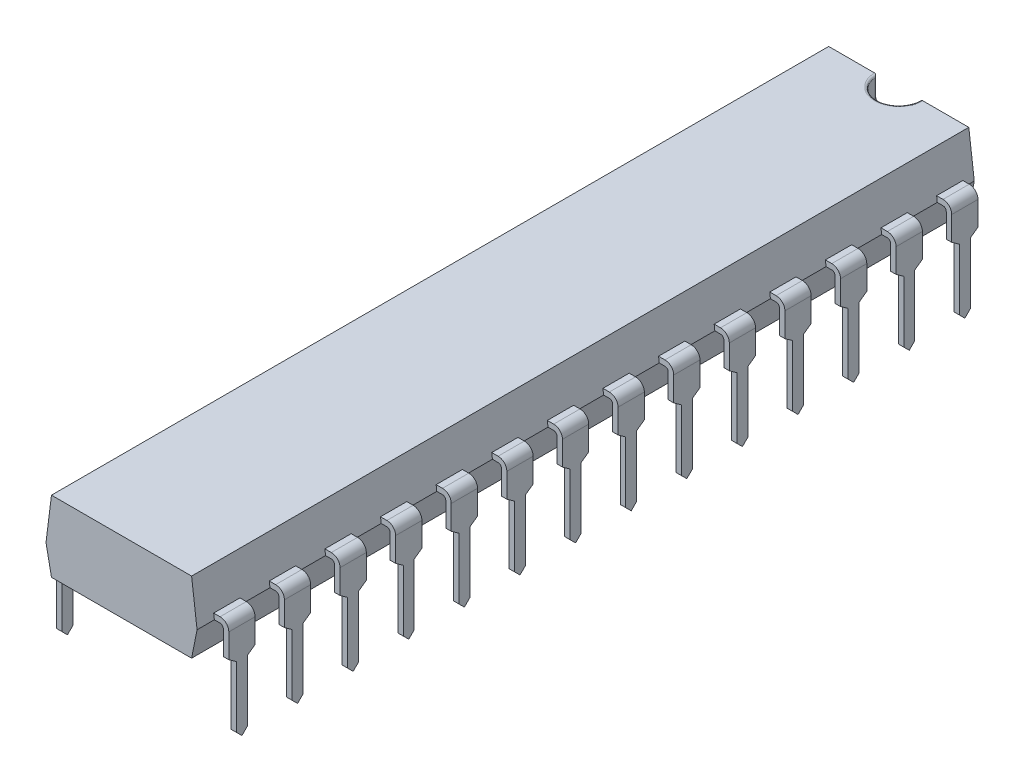
from build123d import *

# Parameters (mm, degrees)
BOSS_EXTRU_1_DEPTH                 = 35.5
BOSS_EXTRU_2_DEPTH                 = 0.6
ENL_V_MAT_EXTRU_1_DEPTH            = 0.5
R_P_TITION_LIN_AIRE1_COUNT         = 14
R_P_TITION_LIN_AIRE1_PITCH         = 2.54
R_P_TITION_LIN_AIRE1_COPY_1_DEPTH  = 0.5
R_P_TITION_LIN_AIRE1_COPY_2_DEPTH  = 0.5
R_P_TITION_LIN_AIRE1_COPY_3_DEPTH  = 0.5
R_P_TITION_LIN_AIRE1_COPY_4_DEPTH  = 0.5
R_P_TITION_LIN_AIRE1_COPY_5_DEPTH  = 0.5
R_P_TITION_LIN_AIRE1_COPY_6_DEPTH  = 0.5
R_P_TITION_LIN_AIRE1_COPY_7_DEPTH  = 0.5
R_P_TITION_LIN_AIRE1_COPY_8_DEPTH  = 0.5
R_P_TITION_LIN_AIRE1_COPY_9_DEPTH  = 0.5
R_P_TITION_LIN_AIRE1_COPY_10_DEPTH = 0.5
R_P_TITION_LIN_AIRE1_COPY_11_DEPTH = 0.5
R_P_TITION_LIN_AIRE1_COPY_12_DEPTH = 0.5
R_P_TITION_LIN_AIRE1_COPY_13_DEPTH = 0.5
SYM_TRIE2_COPY_1_DEPTH             = 0.5
SYM_TRIE2_COPY_2_DEPTH             = 0.6
SYM_TRIE2_COPY_3_DEPTH             = 0.6
SYM_TRIE2_COPY_4_DEPTH             = 0.6
SYM_TRIE2_COPY_5_DEPTH             = 0.6
SYM_TRIE2_COPY_6_DEPTH             = 0.6
SYM_TRIE2_COPY_7_DEPTH             = 0.6
SYM_TRIE2_COPY_8_DEPTH             = 0.6
SYM_TRIE2_COPY_9_DEPTH             = 0.6
SYM_TRIE2_COPY_10_DEPTH            = 0.6
SYM_TRIE2_COPY_11_DEPTH            = 0.6
SYM_TRIE2_COPY_12_DEPTH            = 0.6
SYM_TRIE2_COPY_13_DEPTH            = 0.6
SYM_TRIE2_COPY_14_DEPTH            = 0.6
SYM_TRIE2_COPY_15_DEPTH            = 0.5
SYM_TRIE2_COPY_16_DEPTH            = 0.5
SYM_TRIE2_COPY_17_DEPTH            = 0.5
SYM_TRIE2_COPY_18_DEPTH            = 0.5
SYM_TRIE2_COPY_19_DEPTH            = 0.5
SYM_TRIE2_COPY_20_DEPTH            = 0.5
SYM_TRIE2_COPY_21_DEPTH            = 0.5
SYM_TRIE2_COPY_22_DEPTH            = 0.5
SYM_TRIE2_COPY_23_DEPTH            = 0.5
SYM_TRIE2_COPY_24_DEPTH            = 0.5
SYM_TRIE2_COPY_25_DEPTH            = 0.5
SYM_TRIE2_COPY_26_DEPTH            = 0.5
SYM_TRIE2_COPY_27_DEPTH            = 0.5
SYM_TRIE2_COPY_28_DEPTH            = 0.5
SYM_TRIE2_COPY_29_DEPTH            = 0.5
SYM_TRIE2_COPY_30_DEPTH            = 0.5
SYM_TRIE2_COPY_31_DEPTH            = 0.5
SYM_TRIE2_COPY_32_DEPTH            = 0.5
SYM_TRIE2_COPY_33_DEPTH            = 0.5
SYM_TRIE2_COPY_34_DEPTH            = 0.5
SYM_TRIE2_COPY_35_DEPTH            = 0.5
SYM_TRIE2_COPY_36_DEPTH            = 0.5
SYM_TRIE2_COPY_37_DEPTH            = 0.5
SYM_TRIE2_COPY_38_DEPTH            = 0.5
SYM_TRIE2_COPY_39_DEPTH            = 0.5
SYM_TRIE2_COPY_40_DEPTH            = 0.5
ESQUISSE5_R                        = 1
ENL_V_MAT_EXTRU_2_DEPTH            = 1
CONG_2_R                           = 0.1


with BuildPart() as part:
    # Esquisse1 → Boss.-Extru.1 (new body)
    with BuildSketch(Plane.XY):
        Polygon((-3.45, -0.375), (-3.2, -1.625), (3.2, -1.625), (3.45, -0.375), (3.2, 1.625), (-3.2, 1.625), align=None)
    extrude(amount=BOSS_EXTRU_1_DEPTH)

    # Esquisse3 → Boss.-Extru.2 (add, symmetric)
    with BuildSketch(Plane.XY.offset(1.09)):
        with BuildLine():
            Line((3.185864291, -0.375), (3.71, -0.375))
            ThreePointArc((3.71, -0.375), (3.816066017, -0.418933983), (3.86, -0.525))
            Line((3.86, -0.525), (3.86, -4.925))
            Line((3.86, -4.925), (4.11, -4.925))
            Line((4.11, -4.925), (4.11, -0.525))
            ThreePointArc((4.11, -0.525), (3.992842712, -0.242157288), (3.71, -0.125))
            Line((3.71, -0.125), (3.185864291, -0.125))
            Line((3.185864291, -0.125), (3.185864291, -0.375))
        make_face()
    boss_extru_2 = extrude(amount=BOSS_EXTRU_2_DEPTH, both=True)

    # Esquisse4 → Enlèv. mat.-Extru.1 (cut)
    with BuildSketch(Plane(origin=(4.11, 0, 0), x_dir=(0, 0, -1), z_dir=(1, 0, 0))):
        Polygon((-1.34, -4.675), (-1.34, -1.875), (-1.69, -1.625), (-1.907040734, -1.625), (-1.907040734, -4.925), (-1.09, -4.925), align=None)
    enl_v_mat_extru_1 = extrude(amount=-ENL_V_MAT_EXTRU_1_DEPTH, mode=Mode.SUBTRACT)

    # Symétrie1: Enlèv. mat.-Extru.1 across plane
    add(enl_v_mat_extru_1.mirror(Plane.XY.offset(1.09)), mode=Mode.SUBTRACT)

    # Répétition linéaire1: Boss.-Extru.2, Enlèv. mat.-Extru.1 ×14
    with Locations(*[(0, 0, i * R_P_TITION_LIN_AIRE1_PITCH) for i in range(1, R_P_TITION_LIN_AIRE1_COUNT)]):
        add(boss_extru_2)
        add(enl_v_mat_extru_1, mode=Mode.SUBTRACT)

    # Répétition linéaire1 copy 1 sketch → Répétition linéaire1 copy 1 (cut)
    with BuildSketch(Plane(origin=(4.11, 0, 4.72), x_dir=(0, 0, 1), z_dir=(1, 0, 0))):
        Polygon((-1.34, 4.675), (-1.34, 1.875), (-1.69, 1.625), (-1.907040734, 1.625), (-1.907040734, 4.925), (-1.09, 4.925), align=None)
    extrude(amount=-R_P_TITION_LIN_AIRE1_COPY_1_DEPTH, mode=Mode.SUBTRACT)

    # Répétition linéaire1 copy 2 sketch → Répétition linéaire1 copy 2 (cut)
    with BuildSketch(Plane(origin=(4.11, 0, 7.26), x_dir=(0, 0, 1), z_dir=(1, 0, 0))):
        Polygon((-1.34, 4.675), (-1.34, 1.875), (-1.69, 1.625), (-1.907040734, 1.625), (-1.907040734, 4.925), (-1.09, 4.925), align=None)
    extrude(amount=-R_P_TITION_LIN_AIRE1_COPY_2_DEPTH, mode=Mode.SUBTRACT)

    # Répétition linéaire1 copy 3 sketch → Répétition linéaire1 copy 3 (cut)
    with BuildSketch(Plane(origin=(4.11, 0, 9.8), x_dir=(0, 0, 1), z_dir=(1, 0, 0))):
        Polygon((-1.34, 4.675), (-1.34, 1.875), (-1.69, 1.625), (-1.907040734, 1.625), (-1.907040734, 4.925), (-1.09, 4.925), align=None)
    extrude(amount=-R_P_TITION_LIN_AIRE1_COPY_3_DEPTH, mode=Mode.SUBTRACT)

    # Répétition linéaire1 copy 4 sketch → Répétition linéaire1 copy 4 (cut)
    with BuildSketch(Plane(origin=(4.11, 0, 12.34), x_dir=(0, 0, 1), z_dir=(1, 0, 0))):
        Polygon((-1.34, 4.675), (-1.34, 1.875), (-1.69, 1.625), (-1.907040734, 1.625), (-1.907040734, 4.925), (-1.09, 4.925), align=None)
    extrude(amount=-R_P_TITION_LIN_AIRE1_COPY_4_DEPTH, mode=Mode.SUBTRACT)

    # Répétition linéaire1 copy 5 sketch → Répétition linéaire1 copy 5 (cut)
    with BuildSketch(Plane(origin=(4.11, 0, 14.88), x_dir=(0, 0, 1), z_dir=(1, 0, 0))):
        Polygon((-1.34, 4.675), (-1.34, 1.875), (-1.69, 1.625), (-1.907040734, 1.625), (-1.907040734, 4.925), (-1.09, 4.925), align=None)
    extrude(amount=-R_P_TITION_LIN_AIRE1_COPY_5_DEPTH, mode=Mode.SUBTRACT)

    # Répétition linéaire1 copy 6 sketch → Répétition linéaire1 copy 6 (cut)
    with BuildSketch(Plane(origin=(4.11, 0, 17.42), x_dir=(0, 0, 1), z_dir=(1, 0, 0))):
        Polygon((-1.34, 4.675), (-1.34, 1.875), (-1.69, 1.625), (-1.907040734, 1.625), (-1.907040734, 4.925), (-1.09, 4.925), align=None)
    extrude(amount=-R_P_TITION_LIN_AIRE1_COPY_6_DEPTH, mode=Mode.SUBTRACT)

    # Répétition linéaire1 copy 7 sketch → Répétition linéaire1 copy 7 (cut)
    with BuildSketch(Plane(origin=(4.11, 0, 19.96), x_dir=(0, 0, 1), z_dir=(1, 0, 0))):
        Polygon((-1.34, 4.675), (-1.34, 1.875), (-1.69, 1.625), (-1.907040734, 1.625), (-1.907040734, 4.925), (-1.09, 4.925), align=None)
    extrude(amount=-R_P_TITION_LIN_AIRE1_COPY_7_DEPTH, mode=Mode.SUBTRACT)

    # Répétition linéaire1 copy 8 sketch → Répétition linéaire1 copy 8 (cut)
    with BuildSketch(Plane(origin=(4.11, 0, 22.5), x_dir=(0, 0, 1), z_dir=(1, 0, 0))):
        Polygon((-1.34, 4.675), (-1.34, 1.875), (-1.69, 1.625), (-1.907040734, 1.625), (-1.907040734, 4.925), (-1.09, 4.925), align=None)
    extrude(amount=-R_P_TITION_LIN_AIRE1_COPY_8_DEPTH, mode=Mode.SUBTRACT)

    # Répétition linéaire1 copy 9 sketch → Répétition linéaire1 copy 9 (cut)
    with BuildSketch(Plane(origin=(4.11, 0, 25.04), x_dir=(0, 0, 1), z_dir=(1, 0, 0))):
        Polygon((-1.34, 4.675), (-1.34, 1.875), (-1.69, 1.625), (-1.907040734, 1.625), (-1.907040734, 4.925), (-1.09, 4.925), align=None)
    extrude(amount=-R_P_TITION_LIN_AIRE1_COPY_9_DEPTH, mode=Mode.SUBTRACT)

    # Répétition linéaire1 copy 10 sketch → Répétition linéaire1 copy 10 (cut)
    with BuildSketch(Plane(origin=(4.11, 0, 27.58), x_dir=(0, 0, 1), z_dir=(1, 0, 0))):
        Polygon((-1.34, 4.675), (-1.34, 1.875), (-1.69, 1.625), (-1.907040734, 1.625), (-1.907040734, 4.925), (-1.09, 4.925), align=None)
    extrude(amount=-R_P_TITION_LIN_AIRE1_COPY_10_DEPTH, mode=Mode.SUBTRACT)

    # Répétition linéaire1 copy 11 sketch → Répétition linéaire1 copy 11 (cut)
    with BuildSketch(Plane(origin=(4.11, 0, 30.12), x_dir=(0, 0, 1), z_dir=(1, 0, 0))):
        Polygon((-1.34, 4.675), (-1.34, 1.875), (-1.69, 1.625), (-1.907040734, 1.625), (-1.907040734, 4.925), (-1.09, 4.925), align=None)
    extrude(amount=-R_P_TITION_LIN_AIRE1_COPY_11_DEPTH, mode=Mode.SUBTRACT)

    # Répétition linéaire1 copy 12 sketch → Répétition linéaire1 copy 12 (cut)
    with BuildSketch(Plane(origin=(4.11, 0, 32.66), x_dir=(0, 0, 1), z_dir=(1, 0, 0))):
        Polygon((-1.34, 4.675), (-1.34, 1.875), (-1.69, 1.625), (-1.907040734, 1.625), (-1.907040734, 4.925), (-1.09, 4.925), align=None)
    extrude(amount=-R_P_TITION_LIN_AIRE1_COPY_12_DEPTH, mode=Mode.SUBTRACT)

    # Répétition linéaire1 copy 13 sketch → Répétition linéaire1 copy 13 (cut)
    with BuildSketch(Plane(origin=(4.11, 0, 35.2), x_dir=(0, 0, 1), z_dir=(1, 0, 0))):
        Polygon((-1.34, 4.675), (-1.34, 1.875), (-1.69, 1.625), (-1.907040734, 1.625), (-1.907040734, 4.925), (-1.09, 4.925), align=None)
    extrude(amount=-R_P_TITION_LIN_AIRE1_COPY_13_DEPTH, mode=Mode.SUBTRACT)

    # Symétrie2: Boss.-Extru.2, Enlèv. mat.-Extru.1 across plane
    add(boss_extru_2.mirror(Plane(origin=(0, 0, 0), x_dir=(0, 0, 1), z_dir=(1, 0, 0))))
    add(enl_v_mat_extru_1.mirror(Plane(origin=(0, 0, 0), x_dir=(0, 0, 1), z_dir=(1, 0, 0))), mode=Mode.SUBTRACT)

    # Symétrie2 copy 1 sketch → Symétrie2 copy 1 (cut)
    with BuildSketch(Plane(origin=(-4.11, 0, 2.18), x_dir=(0, 0, 1), z_dir=(-1, 0, 0))):
        Polygon((-1.34, -4.675), (-1.34, -1.875), (-1.69, -1.625), (-1.907040734, -1.625), (-1.907040734, -4.925), (-1.09, -4.925), align=None)
    extrude(amount=-SYM_TRIE2_COPY_1_DEPTH, mode=Mode.SUBTRACT)

    # Symétrie2 copy 2 sketch → Symétrie2 copy 2 (add, symmetric)
    with BuildSketch(Plane(origin=(0, 0, 3.63), x_dir=(-1, 0, 0), z_dir=(0, 0, 1))):
        with BuildLine():
            Line((3.185864291, 0.375), (3.71, 0.375))
            ThreePointArc((3.71, 0.375), (3.816066017, 0.418933983), (3.86, 0.525))
            Line((3.86, 0.525), (3.86, 4.925))
            Line((3.86, 4.925), (4.11, 4.925))
            Line((4.11, 4.925), (4.11, 0.525))
            ThreePointArc((4.11, 0.525), (3.992842712, 0.242157288), (3.71, 0.125))
            Line((3.71, 0.125), (3.185864291, 0.125))
            Line((3.185864291, 0.125), (3.185864291, 0.375))
        make_face()
    extrude(amount=SYM_TRIE2_COPY_2_DEPTH, both=True)

    # Symétrie2 copy 3 sketch → Symétrie2 copy 3 (add, symmetric)
    with BuildSketch(Plane(origin=(0, 0, 6.17), x_dir=(-1, 0, 0), z_dir=(0, 0, 1))):
        with BuildLine():
            Line((3.185864291, 0.375), (3.71, 0.375))
            ThreePointArc((3.71, 0.375), (3.816066017, 0.418933983), (3.86, 0.525))
            Line((3.86, 0.525), (3.86, 4.925))
            Line((3.86, 4.925), (4.11, 4.925))
            Line((4.11, 4.925), (4.11, 0.525))
            ThreePointArc((4.11, 0.525), (3.992842712, 0.242157288), (3.71, 0.125))
            Line((3.71, 0.125), (3.185864291, 0.125))
            Line((3.185864291, 0.125), (3.185864291, 0.375))
        make_face()
    extrude(amount=SYM_TRIE2_COPY_3_DEPTH, both=True)

    # Symétrie2 copy 4 sketch → Symétrie2 copy 4 (add, symmetric)
    with BuildSketch(Plane(origin=(0, 0, 8.71), x_dir=(-1, 0, 0), z_dir=(0, 0, 1))):
        with BuildLine():
            Line((3.185864291, 0.375), (3.71, 0.375))
            ThreePointArc((3.71, 0.375), (3.816066017, 0.418933983), (3.86, 0.525))
            Line((3.86, 0.525), (3.86, 4.925))
            Line((3.86, 4.925), (4.11, 4.925))
            Line((4.11, 4.925), (4.11, 0.525))
            ThreePointArc((4.11, 0.525), (3.992842712, 0.242157288), (3.71, 0.125))
            Line((3.71, 0.125), (3.185864291, 0.125))
            Line((3.185864291, 0.125), (3.185864291, 0.375))
        make_face()
    extrude(amount=SYM_TRIE2_COPY_4_DEPTH, both=True)

    # Symétrie2 copy 5 sketch → Symétrie2 copy 5 (add, symmetric)
    with BuildSketch(Plane(origin=(0, 0, 11.25), x_dir=(-1, 0, 0), z_dir=(0, 0, 1))):
        with BuildLine():
            Line((3.185864291, 0.375), (3.71, 0.375))
            ThreePointArc((3.71, 0.375), (3.816066017, 0.418933983), (3.86, 0.525))
            Line((3.86, 0.525), (3.86, 4.925))
            Line((3.86, 4.925), (4.11, 4.925))
            Line((4.11, 4.925), (4.11, 0.525))
            ThreePointArc((4.11, 0.525), (3.992842712, 0.242157288), (3.71, 0.125))
            Line((3.71, 0.125), (3.185864291, 0.125))
            Line((3.185864291, 0.125), (3.185864291, 0.375))
        make_face()
    extrude(amount=SYM_TRIE2_COPY_5_DEPTH, both=True)

    # Symétrie2 copy 6 sketch → Symétrie2 copy 6 (add, symmetric)
    with BuildSketch(Plane(origin=(0, 0, 13.79), x_dir=(-1, 0, 0), z_dir=(0, 0, 1))):
        with BuildLine():
            Line((3.185864291, 0.375), (3.71, 0.375))
            ThreePointArc((3.71, 0.375), (3.816066017, 0.418933983), (3.86, 0.525))
            Line((3.86, 0.525), (3.86, 4.925))
            Line((3.86, 4.925), (4.11, 4.925))
            Line((4.11, 4.925), (4.11, 0.525))
            ThreePointArc((4.11, 0.525), (3.992842712, 0.242157288), (3.71, 0.125))
            Line((3.71, 0.125), (3.185864291, 0.125))
            Line((3.185864291, 0.125), (3.185864291, 0.375))
        make_face()
    extrude(amount=SYM_TRIE2_COPY_6_DEPTH, both=True)

    # Symétrie2 copy 7 sketch → Symétrie2 copy 7 (add, symmetric)
    with BuildSketch(Plane(origin=(0, 0, 16.33), x_dir=(-1, 0, 0), z_dir=(0, 0, 1))):
        with BuildLine():
            Line((3.185864291, 0.375), (3.71, 0.375))
            ThreePointArc((3.71, 0.375), (3.816066017, 0.418933983), (3.86, 0.525))
            Line((3.86, 0.525), (3.86, 4.925))
            Line((3.86, 4.925), (4.11, 4.925))
            Line((4.11, 4.925), (4.11, 0.525))
            ThreePointArc((4.11, 0.525), (3.992842712, 0.242157288), (3.71, 0.125))
            Line((3.71, 0.125), (3.185864291, 0.125))
            Line((3.185864291, 0.125), (3.185864291, 0.375))
        make_face()
    extrude(amount=SYM_TRIE2_COPY_7_DEPTH, both=True)

    # Symétrie2 copy 8 sketch → Symétrie2 copy 8 (add, symmetric)
    with BuildSketch(Plane(origin=(0, 0, 18.87), x_dir=(-1, 0, 0), z_dir=(0, 0, 1))):
        with BuildLine():
            Line((3.185864291, 0.375), (3.71, 0.375))
            ThreePointArc((3.71, 0.375), (3.816066017, 0.418933983), (3.86, 0.525))
            Line((3.86, 0.525), (3.86, 4.925))
            Line((3.86, 4.925), (4.11, 4.925))
            Line((4.11, 4.925), (4.11, 0.525))
            ThreePointArc((4.11, 0.525), (3.992842712, 0.242157288), (3.71, 0.125))
            Line((3.71, 0.125), (3.185864291, 0.125))
            Line((3.185864291, 0.125), (3.185864291, 0.375))
        make_face()
    extrude(amount=SYM_TRIE2_COPY_8_DEPTH, both=True)

    # Symétrie2 copy 9 sketch → Symétrie2 copy 9 (add, symmetric)
    with BuildSketch(Plane(origin=(0, 0, 21.41), x_dir=(-1, 0, 0), z_dir=(0, 0, 1))):
        with BuildLine():
            Line((3.185864291, 0.375), (3.71, 0.375))
            ThreePointArc((3.71, 0.375), (3.816066017, 0.418933983), (3.86, 0.525))
            Line((3.86, 0.525), (3.86, 4.925))
            Line((3.86, 4.925), (4.11, 4.925))
            Line((4.11, 4.925), (4.11, 0.525))
            ThreePointArc((4.11, 0.525), (3.992842712, 0.242157288), (3.71, 0.125))
            Line((3.71, 0.125), (3.185864291, 0.125))
            Line((3.185864291, 0.125), (3.185864291, 0.375))
        make_face()
    extrude(amount=SYM_TRIE2_COPY_9_DEPTH, both=True)

    # Symétrie2 copy 10 sketch → Symétrie2 copy 10 (add, symmetric)
    with BuildSketch(Plane(origin=(0, 0, 23.95), x_dir=(-1, 0, 0), z_dir=(0, 0, 1))):
        with BuildLine():
            Line((3.185864291, 0.375), (3.71, 0.375))
            ThreePointArc((3.71, 0.375), (3.816066017, 0.418933983), (3.86, 0.525))
            Line((3.86, 0.525), (3.86, 4.925))
            Line((3.86, 4.925), (4.11, 4.925))
            Line((4.11, 4.925), (4.11, 0.525))
            ThreePointArc((4.11, 0.525), (3.992842712, 0.242157288), (3.71, 0.125))
            Line((3.71, 0.125), (3.185864291, 0.125))
            Line((3.185864291, 0.125), (3.185864291, 0.375))
        make_face()
    extrude(amount=SYM_TRIE2_COPY_10_DEPTH, both=True)

    # Symétrie2 copy 11 sketch → Symétrie2 copy 11 (add, symmetric)
    with BuildSketch(Plane(origin=(0, 0, 26.49), x_dir=(-1, 0, 0), z_dir=(0, 0, 1))):
        with BuildLine():
            Line((3.185864291, 0.375), (3.71, 0.375))
            ThreePointArc((3.71, 0.375), (3.816066017, 0.418933983), (3.86, 0.525))
            Line((3.86, 0.525), (3.86, 4.925))
            Line((3.86, 4.925), (4.11, 4.925))
            Line((4.11, 4.925), (4.11, 0.525))
            ThreePointArc((4.11, 0.525), (3.992842712, 0.242157288), (3.71, 0.125))
            Line((3.71, 0.125), (3.185864291, 0.125))
            Line((3.185864291, 0.125), (3.185864291, 0.375))
        make_face()
    extrude(amount=SYM_TRIE2_COPY_11_DEPTH, both=True)

    # Symétrie2 copy 12 sketch → Symétrie2 copy 12 (add, symmetric)
    with BuildSketch(Plane(origin=(0, 0, 29.03), x_dir=(-1, 0, 0), z_dir=(0, 0, 1))):
        with BuildLine():
            Line((3.185864291, 0.375), (3.71, 0.375))
            ThreePointArc((3.71, 0.375), (3.816066017, 0.418933983), (3.86, 0.525))
            Line((3.86, 0.525), (3.86, 4.925))
            Line((3.86, 4.925), (4.11, 4.925))
            Line((4.11, 4.925), (4.11, 0.525))
            ThreePointArc((4.11, 0.525), (3.992842712, 0.242157288), (3.71, 0.125))
            Line((3.71, 0.125), (3.185864291, 0.125))
            Line((3.185864291, 0.125), (3.185864291, 0.375))
        make_face()
    extrude(amount=SYM_TRIE2_COPY_12_DEPTH, both=True)

    # Symétrie2 copy 13 sketch → Symétrie2 copy 13 (add, symmetric)
    with BuildSketch(Plane(origin=(0, 0, 31.57), x_dir=(-1, 0, 0), z_dir=(0, 0, 1))):
        with BuildLine():
            Line((3.185864291, 0.375), (3.71, 0.375))
            ThreePointArc((3.71, 0.375), (3.816066017, 0.418933983), (3.86, 0.525))
            Line((3.86, 0.525), (3.86, 4.925))
            Line((3.86, 4.925), (4.11, 4.925))
            Line((4.11, 4.925), (4.11, 0.525))
            ThreePointArc((4.11, 0.525), (3.992842712, 0.242157288), (3.71, 0.125))
            Line((3.71, 0.125), (3.185864291, 0.125))
            Line((3.185864291, 0.125), (3.185864291, 0.375))
        make_face()
    extrude(amount=SYM_TRIE2_COPY_13_DEPTH, both=True)

    # Symétrie2 copy 14 sketch → Symétrie2 copy 14 (add, symmetric)
    with BuildSketch(Plane(origin=(0, 0, 34.11), x_dir=(-1, 0, 0), z_dir=(0, 0, 1))):
        with BuildLine():
            Line((3.185864291, 0.375), (3.71, 0.375))
            ThreePointArc((3.71, 0.375), (3.816066017, 0.418933983), (3.86, 0.525))
            Line((3.86, 0.525), (3.86, 4.925))
            Line((3.86, 4.925), (4.11, 4.925))
            Line((4.11, 4.925), (4.11, 0.525))
            ThreePointArc((4.11, 0.525), (3.992842712, 0.242157288), (3.71, 0.125))
            Line((3.71, 0.125), (3.185864291, 0.125))
            Line((3.185864291, 0.125), (3.185864291, 0.375))
        make_face()
    extrude(amount=SYM_TRIE2_COPY_14_DEPTH, both=True)

    # Symétrie2 copy 15 sketch → Symétrie2 copy 15 (cut)
    with BuildSketch(Plane(origin=(-4.11, 0, 2.54), x_dir=(0, 0, -1), z_dir=(-1, 0, 0))):
        Polygon((-1.34, 4.675), (-1.34, 1.875), (-1.69, 1.625), (-1.907040734, 1.625), (-1.907040734, 4.925), (-1.09, 4.925), align=None)
    extrude(amount=-SYM_TRIE2_COPY_15_DEPTH, mode=Mode.SUBTRACT)

    # Symétrie2 copy 16 sketch → Symétrie2 copy 16 (cut)
    with BuildSketch(Plane(origin=(-4.11, 0, 5.08), x_dir=(0, 0, -1), z_dir=(-1, 0, 0))):
        Polygon((-1.34, 4.675), (-1.34, 1.875), (-1.69, 1.625), (-1.907040734, 1.625), (-1.907040734, 4.925), (-1.09, 4.925), align=None)
    extrude(amount=-SYM_TRIE2_COPY_16_DEPTH, mode=Mode.SUBTRACT)

    # Symétrie2 copy 17 sketch → Symétrie2 copy 17 (cut)
    with BuildSketch(Plane(origin=(-4.11, 0, 7.62), x_dir=(0, 0, -1), z_dir=(-1, 0, 0))):
        Polygon((-1.34, 4.675), (-1.34, 1.875), (-1.69, 1.625), (-1.907040734, 1.625), (-1.907040734, 4.925), (-1.09, 4.925), align=None)
    extrude(amount=-SYM_TRIE2_COPY_17_DEPTH, mode=Mode.SUBTRACT)

    # Symétrie2 copy 18 sketch → Symétrie2 copy 18 (cut)
    with BuildSketch(Plane(origin=(-4.11, 0, 10.16), x_dir=(0, 0, -1), z_dir=(-1, 0, 0))):
        Polygon((-1.34, 4.675), (-1.34, 1.875), (-1.69, 1.625), (-1.907040734, 1.625), (-1.907040734, 4.925), (-1.09, 4.925), align=None)
    extrude(amount=-SYM_TRIE2_COPY_18_DEPTH, mode=Mode.SUBTRACT)

    # Symétrie2 copy 19 sketch → Symétrie2 copy 19 (cut)
    with BuildSketch(Plane(origin=(-4.11, 0, 12.7), x_dir=(0, 0, -1), z_dir=(-1, 0, 0))):
        Polygon((-1.34, 4.675), (-1.34, 1.875), (-1.69, 1.625), (-1.907040734, 1.625), (-1.907040734, 4.925), (-1.09, 4.925), align=None)
    extrude(amount=-SYM_TRIE2_COPY_19_DEPTH, mode=Mode.SUBTRACT)

    # Symétrie2 copy 20 sketch → Symétrie2 copy 20 (cut)
    with BuildSketch(Plane(origin=(-4.11, 0, 15.24), x_dir=(0, 0, -1), z_dir=(-1, 0, 0))):
        Polygon((-1.34, 4.675), (-1.34, 1.875), (-1.69, 1.625), (-1.907040734, 1.625), (-1.907040734, 4.925), (-1.09, 4.925), align=None)
    extrude(amount=-SYM_TRIE2_COPY_20_DEPTH, mode=Mode.SUBTRACT)

    # Symétrie2 copy 21 sketch → Symétrie2 copy 21 (cut)
    with BuildSketch(Plane(origin=(-4.11, 0, 17.78), x_dir=(0, 0, -1), z_dir=(-1, 0, 0))):
        Polygon((-1.34, 4.675), (-1.34, 1.875), (-1.69, 1.625), (-1.907040734, 1.625), (-1.907040734, 4.925), (-1.09, 4.925), align=None)
    extrude(amount=-SYM_TRIE2_COPY_21_DEPTH, mode=Mode.SUBTRACT)

    # Symétrie2 copy 22 sketch → Symétrie2 copy 22 (cut)
    with BuildSketch(Plane(origin=(-4.11, 0, 20.32), x_dir=(0, 0, -1), z_dir=(-1, 0, 0))):
        Polygon((-1.34, 4.675), (-1.34, 1.875), (-1.69, 1.625), (-1.907040734, 1.625), (-1.907040734, 4.925), (-1.09, 4.925), align=None)
    extrude(amount=-SYM_TRIE2_COPY_22_DEPTH, mode=Mode.SUBTRACT)

    # Symétrie2 copy 23 sketch → Symétrie2 copy 23 (cut)
    with BuildSketch(Plane(origin=(-4.11, 0, 22.86), x_dir=(0, 0, -1), z_dir=(-1, 0, 0))):
        Polygon((-1.34, 4.675), (-1.34, 1.875), (-1.69, 1.625), (-1.907040734, 1.625), (-1.907040734, 4.925), (-1.09, 4.925), align=None)
    extrude(amount=-SYM_TRIE2_COPY_23_DEPTH, mode=Mode.SUBTRACT)

    # Symétrie2 copy 24 sketch → Symétrie2 copy 24 (cut)
    with BuildSketch(Plane(origin=(-4.11, 0, 25.4), x_dir=(0, 0, -1), z_dir=(-1, 0, 0))):
        Polygon((-1.34, 4.675), (-1.34, 1.875), (-1.69, 1.625), (-1.907040734, 1.625), (-1.907040734, 4.925), (-1.09, 4.925), align=None)
    extrude(amount=-SYM_TRIE2_COPY_24_DEPTH, mode=Mode.SUBTRACT)

    # Symétrie2 copy 25 sketch → Symétrie2 copy 25 (cut)
    with BuildSketch(Plane(origin=(-4.11, 0, 27.94), x_dir=(0, 0, -1), z_dir=(-1, 0, 0))):
        Polygon((-1.34, 4.675), (-1.34, 1.875), (-1.69, 1.625), (-1.907040734, 1.625), (-1.907040734, 4.925), (-1.09, 4.925), align=None)
    extrude(amount=-SYM_TRIE2_COPY_25_DEPTH, mode=Mode.SUBTRACT)

    # Symétrie2 copy 26 sketch → Symétrie2 copy 26 (cut)
    with BuildSketch(Plane(origin=(-4.11, 0, 30.48), x_dir=(0, 0, -1), z_dir=(-1, 0, 0))):
        Polygon((-1.34, 4.675), (-1.34, 1.875), (-1.69, 1.625), (-1.907040734, 1.625), (-1.907040734, 4.925), (-1.09, 4.925), align=None)
    extrude(amount=-SYM_TRIE2_COPY_26_DEPTH, mode=Mode.SUBTRACT)

    # Symétrie2 copy 27 sketch → Symétrie2 copy 27 (cut)
    with BuildSketch(Plane(origin=(-4.11, 0, 33.02), x_dir=(0, 0, -1), z_dir=(-1, 0, 0))):
        Polygon((-1.34, 4.675), (-1.34, 1.875), (-1.69, 1.625), (-1.907040734, 1.625), (-1.907040734, 4.925), (-1.09, 4.925), align=None)
    extrude(amount=-SYM_TRIE2_COPY_27_DEPTH, mode=Mode.SUBTRACT)

    # Symétrie2 copy 28 sketch → Symétrie2 copy 28 (cut)
    with BuildSketch(Plane(origin=(-4.11, 0, 4.72), x_dir=(0, 0, 1), z_dir=(-1, 0, 0))):
        Polygon((-1.34, -4.675), (-1.34, -1.875), (-1.69, -1.625), (-1.907040734, -1.625), (-1.907040734, -4.925), (-1.09, -4.925), align=None)
    extrude(amount=-SYM_TRIE2_COPY_28_DEPTH, mode=Mode.SUBTRACT)

    # Symétrie2 copy 29 sketch → Symétrie2 copy 29 (cut)
    with BuildSketch(Plane(origin=(-4.11, 0, 7.26), x_dir=(0, 0, 1), z_dir=(-1, 0, 0))):
        Polygon((-1.34, -4.675), (-1.34, -1.875), (-1.69, -1.625), (-1.907040734, -1.625), (-1.907040734, -4.925), (-1.09, -4.925), align=None)
    extrude(amount=-SYM_TRIE2_COPY_29_DEPTH, mode=Mode.SUBTRACT)

    # Symétrie2 copy 30 sketch → Symétrie2 copy 30 (cut)
    with BuildSketch(Plane(origin=(-4.11, 0, 9.8), x_dir=(0, 0, 1), z_dir=(-1, 0, 0))):
        Polygon((-1.34, -4.675), (-1.34, -1.875), (-1.69, -1.625), (-1.907040734, -1.625), (-1.907040734, -4.925), (-1.09, -4.925), align=None)
    extrude(amount=-SYM_TRIE2_COPY_30_DEPTH, mode=Mode.SUBTRACT)

    # Symétrie2 copy 31 sketch → Symétrie2 copy 31 (cut)
    with BuildSketch(Plane(origin=(-4.11, 0, 12.34), x_dir=(0, 0, 1), z_dir=(-1, 0, 0))):
        Polygon((-1.34, -4.675), (-1.34, -1.875), (-1.69, -1.625), (-1.907040734, -1.625), (-1.907040734, -4.925), (-1.09, -4.925), align=None)
    extrude(amount=-SYM_TRIE2_COPY_31_DEPTH, mode=Mode.SUBTRACT)

    # Symétrie2 copy 32 sketch → Symétrie2 copy 32 (cut)
    with BuildSketch(Plane(origin=(-4.11, 0, 14.88), x_dir=(0, 0, 1), z_dir=(-1, 0, 0))):
        Polygon((-1.34, -4.675), (-1.34, -1.875), (-1.69, -1.625), (-1.907040734, -1.625), (-1.907040734, -4.925), (-1.09, -4.925), align=None)
    extrude(amount=-SYM_TRIE2_COPY_32_DEPTH, mode=Mode.SUBTRACT)

    # Symétrie2 copy 33 sketch → Symétrie2 copy 33 (cut)
    with BuildSketch(Plane(origin=(-4.11, 0, 17.42), x_dir=(0, 0, 1), z_dir=(-1, 0, 0))):
        Polygon((-1.34, -4.675), (-1.34, -1.875), (-1.69, -1.625), (-1.907040734, -1.625), (-1.907040734, -4.925), (-1.09, -4.925), align=None)
    extrude(amount=-SYM_TRIE2_COPY_33_DEPTH, mode=Mode.SUBTRACT)

    # Symétrie2 copy 34 sketch → Symétrie2 copy 34 (cut)
    with BuildSketch(Plane(origin=(-4.11, 0, 19.96), x_dir=(0, 0, 1), z_dir=(-1, 0, 0))):
        Polygon((-1.34, -4.675), (-1.34, -1.875), (-1.69, -1.625), (-1.907040734, -1.625), (-1.907040734, -4.925), (-1.09, -4.925), align=None)
    extrude(amount=-SYM_TRIE2_COPY_34_DEPTH, mode=Mode.SUBTRACT)

    # Symétrie2 copy 35 sketch → Symétrie2 copy 35 (cut)
    with BuildSketch(Plane(origin=(-4.11, 0, 22.5), x_dir=(0, 0, 1), z_dir=(-1, 0, 0))):
        Polygon((-1.34, -4.675), (-1.34, -1.875), (-1.69, -1.625), (-1.907040734, -1.625), (-1.907040734, -4.925), (-1.09, -4.925), align=None)
    extrude(amount=-SYM_TRIE2_COPY_35_DEPTH, mode=Mode.SUBTRACT)

    # Symétrie2 copy 36 sketch → Symétrie2 copy 36 (cut)
    with BuildSketch(Plane(origin=(-4.11, 0, 25.04), x_dir=(0, 0, 1), z_dir=(-1, 0, 0))):
        Polygon((-1.34, -4.675), (-1.34, -1.875), (-1.69, -1.625), (-1.907040734, -1.625), (-1.907040734, -4.925), (-1.09, -4.925), align=None)
    extrude(amount=-SYM_TRIE2_COPY_36_DEPTH, mode=Mode.SUBTRACT)

    # Symétrie2 copy 37 sketch → Symétrie2 copy 37 (cut)
    with BuildSketch(Plane(origin=(-4.11, 0, 27.58), x_dir=(0, 0, 1), z_dir=(-1, 0, 0))):
        Polygon((-1.34, -4.675), (-1.34, -1.875), (-1.69, -1.625), (-1.907040734, -1.625), (-1.907040734, -4.925), (-1.09, -4.925), align=None)
    extrude(amount=-SYM_TRIE2_COPY_37_DEPTH, mode=Mode.SUBTRACT)

    # Symétrie2 copy 38 sketch → Symétrie2 copy 38 (cut)
    with BuildSketch(Plane(origin=(-4.11, 0, 30.12), x_dir=(0, 0, 1), z_dir=(-1, 0, 0))):
        Polygon((-1.34, -4.675), (-1.34, -1.875), (-1.69, -1.625), (-1.907040734, -1.625), (-1.907040734, -4.925), (-1.09, -4.925), align=None)
    extrude(amount=-SYM_TRIE2_COPY_38_DEPTH, mode=Mode.SUBTRACT)

    # Symétrie2 copy 39 sketch → Symétrie2 copy 39 (cut)
    with BuildSketch(Plane(origin=(-4.11, 0, 32.66), x_dir=(0, 0, 1), z_dir=(-1, 0, 0))):
        Polygon((-1.34, -4.675), (-1.34, -1.875), (-1.69, -1.625), (-1.907040734, -1.625), (-1.907040734, -4.925), (-1.09, -4.925), align=None)
    extrude(amount=-SYM_TRIE2_COPY_39_DEPTH, mode=Mode.SUBTRACT)

    # Symétrie2 copy 40 sketch → Symétrie2 copy 40 (cut)
    with BuildSketch(Plane(origin=(-4.11, 0, 35.2), x_dir=(0, 0, 1), z_dir=(-1, 0, 0))):
        Polygon((-1.34, -4.675), (-1.34, -1.875), (-1.69, -1.625), (-1.907040734, -1.625), (-1.907040734, -4.925), (-1.09, -4.925), align=None)
    extrude(amount=-SYM_TRIE2_COPY_40_DEPTH, mode=Mode.SUBTRACT)

    # Esquisse5 → Enlèv. mat.-Extru.2 (cut)
    with BuildSketch(Plane(origin=(0, 1.625, 0), x_dir=(1, 0, 0), z_dir=(0, 1, 0))):
        Circle(ESQUISSE5_R)
    extrude(amount=-ENL_V_MAT_EXTRU_2_DEPTH, mode=Mode.SUBTRACT)

    # Congé2
    cong_2_edges = [part.edges().sort_by_distance(p)[0] for p in [
        (0, 0.625, 0),
        (1, 1.125, 0),
        (-1, 1.125, 0),
        (0, 0.625, 1),
        (0, 1.625, 1),
    ]]
    fillet(cong_2_edges, radius=CONG_2_R)


solid = part.part
